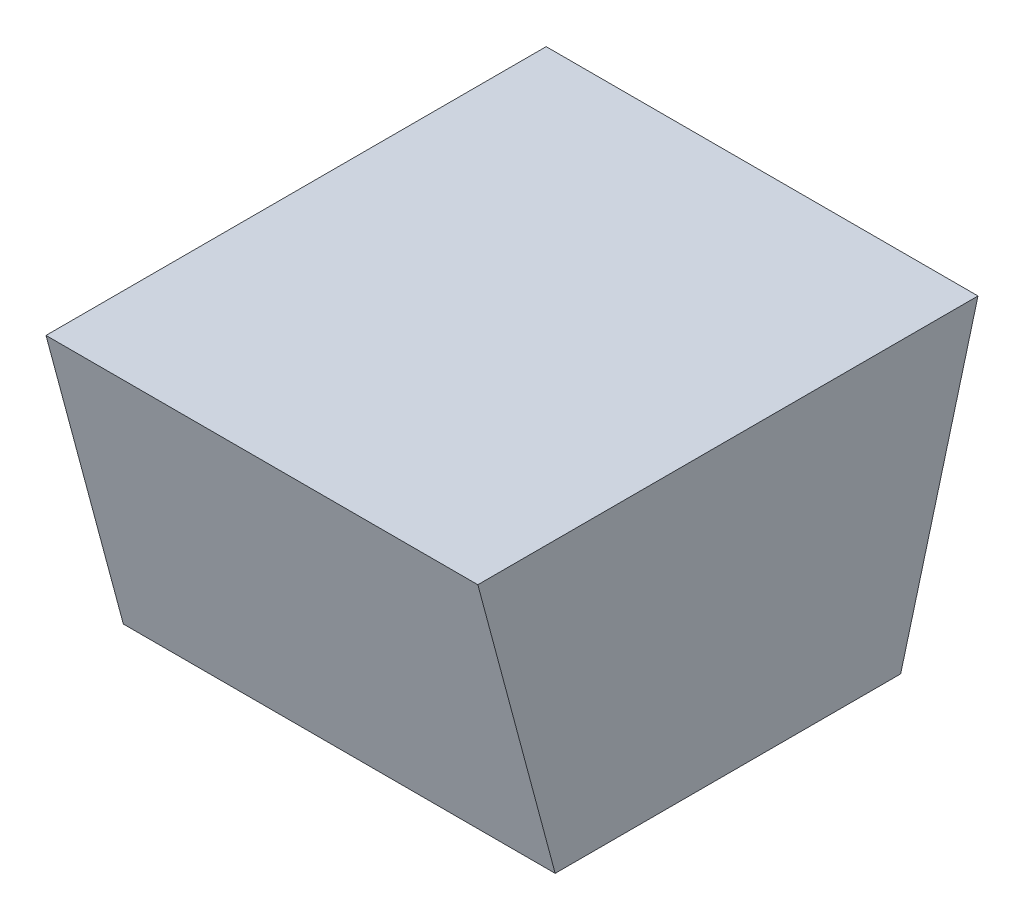
from build123d import *

# Parameters (mm, degrees)
SKETCH_TL_CUTTING_R    = 1.997499942
TL_CUTTING_DEPTH       = 29.999999944
SKETCH_TDF_CUTTING_W   = 4.014999844
SKETCH_TDF_CUTTING_H   = 4.014999844
TDF_CUTTING_DEPTH      = 31.132706627
VW_VR_GRINDING_DEPTH   = 2.007499922
VW_VR_GRINDING_2_DEPTH = 2.007499922
ISA_GRINDING_DEPTH     = 2.007499922
SKETCH_PRE_FRX_BRX_W   = 0.939999898
SKETCH_PRE_FRX_BRX_H   = 1.62600005
SKETCH_PRE_FRX_BRX_W_2 = 1.814999926
PRE_FRX_BRX_DEPTH      = 2.007499922
FA_BA_GRINDING_DEPTH   = 2.007499922


with BuildPart() as part:
    # sketch_TL_cutting → TL_cutting (new body)
    with BuildSketch(Plane(origin=(0, 0, 0), x_dir=(1, 0, 0), z_dir=(0, 1, 0))):
        with Locations(Location((0, 0, 0), (0, 0, 270))):
            Circle(SKETCH_TL_CUTTING_R)
    extrude(amount=TL_CUTTING_DEPTH)

    # sketch_TDF_cutting → TDF_cutting (cut, through all)
    with BuildSketch(Plane(origin=(0, 0, 0), x_dir=(1, 0, 0), z_dir=(0, 1, 0))):
        with Locations((-3.609999892, 0)):
            Rectangle(SKETCH_TDF_CUTTING_W, SKETCH_TDF_CUTTING_H)
    extrude(amount=TDF_CUTTING_DEPTH, mode=Mode.SUBTRACT)


with BuildPart() as body_2:
    # sketch_VW_VR_grinding → VW_VR_grinding (new, symmetric)
    with BuildSketch(Plane(origin=(0, 0, 0), x_dir=(0, 0, -1), z_dir=(1, 0, 0))):
        with BuildLine():
            Line((-1.589999995, -0.00999998), (-1.589999995, 9.99888896))
            ThreePointArc((-1.589999995, 9.99888896), (-1.590048322, 9.999995838), (-1.590192937, 10.001094292))
            Line((-1.590192937, 10.001094292), (-2.017499902, 12.424472516))
            Line((-2.017499902, 12.424472516), (-2.007499922, -0.00999998))
            Line((-2.007499922, -0.00999998), (-1.589999995, -0.00999998))
        make_face()
    extrude(amount=VW_VR_GRINDING_DEPTH, both=True)


with BuildPart() as body_3:
    # sketch_VW_VR_grinding → VW_VR_grinding 2 (new, symmetric)
    with BuildSketch(Plane(origin=(0, 0, 0), x_dir=(0, 0, -1), z_dir=(1, 0, 0))):
        with BuildLine():
            Line((1.589999995, -0.00999998), (1.589999995, 9.99888896))
            ThreePointArc((1.589999995, 9.99888896), (1.590048322, 9.999995838), (1.590192937, 10.001094292))
            Line((1.590192937, 10.001094292), (2.017499902, 12.424472516))
            Line((2.017499902, 12.424472516), (2.007499922, -0.00999998))
            Line((2.007499922, -0.00999998), (1.589999995, -0.00999998))
        make_face()
    extrude(amount=VW_VR_GRINDING_2_DEPTH, both=True)


    add(body_2.part)  # ISA_grinding merges body 2
    # sketch_ISA_grinding → ISA_grinding (add, symmetric)
    with BuildSketch(Plane(origin=(0, 0, 0), x_dir=(0, 0, -1), z_dir=(1, 0, 0))):
        Polygon((-0.500000016, 0), (0.500000016, 0), (2.007499922, 5.626066242), (2.007499922, -0.02999994), (-2.007499922, -0.02999994), (-2.007499922, 5.626066242), align=None)
    extrude(amount=ISA_GRINDING_DEPTH, both=True)

    # sketch_pre_FRX_BRX → pre_FRX_BRX (add, symmetric)
    with BuildSketch(Plane.XY):
        with Locations((1.527499993, 0.803000045)):
            Rectangle(SKETCH_PRE_FRX_BRX_W, SKETCH_PRE_FRX_BRX_H)
        with Locations((-1.109999939, 0.803000045)):
            Rectangle(SKETCH_PRE_FRX_BRX_W_2, SKETCH_PRE_FRX_BRX_H)
    extrude(amount=PRE_FRX_BRX_DEPTH, both=True)

    # sketch_FA_BA_grinding → FA_BA_grinding (add, symmetric)
    with BuildSketch(Plane.XY):
        Polygon((1.047500064, -0.00999998), (1.047500064, 1.62600005), (2.124499942, 9.289252373), (2.124499942, -0.00999998), align=None)
        Polygon((-0.202499976, -0.00999998), (-0.202499976, 1.62600005), (-1.72949997, 12.491169573), (-1.72949997, -0.00999998), align=None)
    extrude(amount=FA_BA_GRINDING_DEPTH, both=True)


with BuildPart() as part_1:
    add(part.part)

    # B1_fix: cut body 3
    add(body_3.part, mode=Mode.SUBTRACT)

    # SurfaceCut1
    split(bisect_by=Plane(origin=(0, 0.835526316, 0), x_dir=(1, 0, 0), z_dir=(0, 1, 0)), keep=Keep.BOTTOM)


solid = part_1.part
